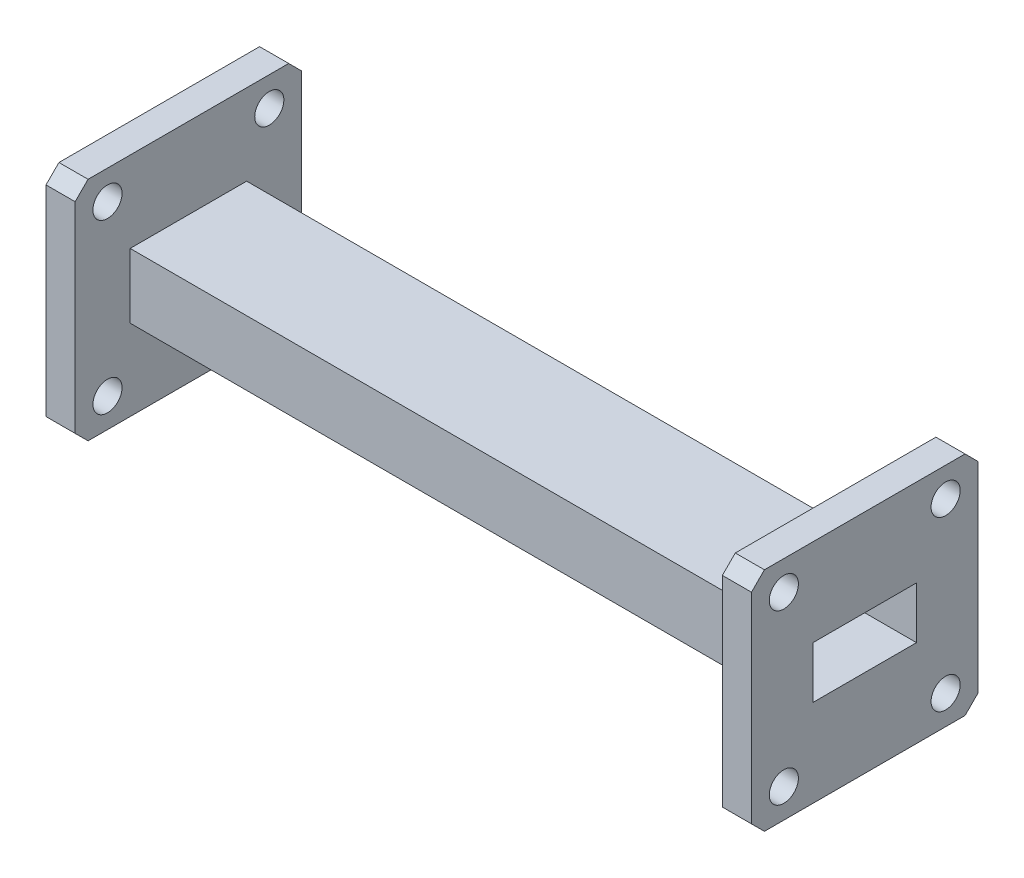
from build123d import *

# Parameters (mm, degrees)
SKETCH_1_W                  = 35
SKETCH_1_H                  = 35
SKETCH_1_W_2                = 16
SKETCH_1_H_2                = 8
EXTRUDE_1_DEPTH             = 4.5
CHAMFER_1_SIZE              = 2
SKETCH_4_W                  = 18
SKETCH_4_H                  = 10
SKETCH_4_W_2                = 16
SKETCH_4_H_2                = 8
EXTRUDE_2_DEPTH             = 100
SKETCH_5_W                  = 35
SKETCH_5_H                  = 35
SKETCH_5_W_2                = 16
SKETCH_5_H_2                = 8
EXTRUDE_3_DEPTH             = 4.5
CHAMFER_2_SIZE              = 2
HOLE_WIZARD_4_5_4_5_2_D     = 4.5
PATTERN_LINEAR_1_COUNT      = 2
PATTERN_LINEAR_1_PITCH      = 25
PATTERN_LINEAR_1_COUNT_DIR2 = 2
PATTERN_LINEAR_1_PITCH_DIR2 = 26


with BuildPart() as part:
    # Эскиз1 → Бобышка-Вытянуть1 (new body)
    with BuildSketch(Plane(origin=(0, 0, 0), x_dir=(0, 0, -1), z_dir=(1, 0, 0))):
        Rectangle(SKETCH_1_W, SKETCH_1_H)
        Rectangle(SKETCH_1_W_2, SKETCH_1_H_2, mode=Mode.SUBTRACT)
    extrude(amount=EXTRUDE_1_DEPTH)

    # Фаска1
    chamfer_1_edges = [part.edges().sort_by_distance(p)[0] for p in [
        (2.25, -17.5, 17.5),
        (2.25, -17.5, -17.5),
        (2.25, 17.5, -17.5),
        (2.25, 17.5, 17.5),
    ]]
    chamfer(chamfer_1_edges, length=CHAMFER_1_SIZE)

    # Эскиз4 → Бобышка-Вытянуть2 (add)
    with BuildSketch(Plane(origin=(4.5, 0, 0), x_dir=(0, 0, -1), z_dir=(1, 0, 0))):
        Rectangle(SKETCH_4_W, SKETCH_4_H)
        Rectangle(SKETCH_4_W_2, SKETCH_4_H_2, mode=Mode.SUBTRACT)
    extrude(amount=EXTRUDE_2_DEPTH)

    # Эскиз5 → Бобышка-Вытянуть3 (add)
    with BuildSketch(Plane(origin=(104.5, 0, 0), x_dir=(0, 0, -1), z_dir=(1, 0, 0))):
        Rectangle(SKETCH_5_W, SKETCH_5_H)
        Rectangle(SKETCH_5_W_2, SKETCH_5_H_2, mode=Mode.SUBTRACT)
    extrude(amount=EXTRUDE_3_DEPTH)

    # Фаска2
    chamfer_2_edges = [part.edges().sort_by_distance(p)[0] for p in [
        (106.75, -17.5, 17.5),
        (106.75, -17.5, -17.5),
        (106.75, 17.5, -17.5),
        (106.75, 17.5, 17.5),
    ]]
    chamfer(chamfer_2_edges, length=CHAMFER_2_SIZE)

    # Диаметр отверстия Ø4.5 (4.5)2 (through all)
    with Locations(Plane(origin=(0, 13, 12.5), x_dir=(0, 0, -1), z_dir=(-1, 0, 0))):
        with Locations((0, 0)):
            hole_wizard_4_5_4_5_2 = Hole(HOLE_WIZARD_4_5_4_5_2_D / 2)

    # Линейный массив1: Hole Wizard 4.5 _4.5_2 2 × 2
    with Locations(*[(0, -j * PATTERN_LINEAR_1_PITCH_DIR2, -i * PATTERN_LINEAR_1_PITCH) for i in range(PATTERN_LINEAR_1_COUNT) for j in range(PATTERN_LINEAR_1_COUNT_DIR2) if (i, j) != (0, 0)]):
        add(hole_wizard_4_5_4_5_2, mode=Mode.SUBTRACT)


solid = part.part
